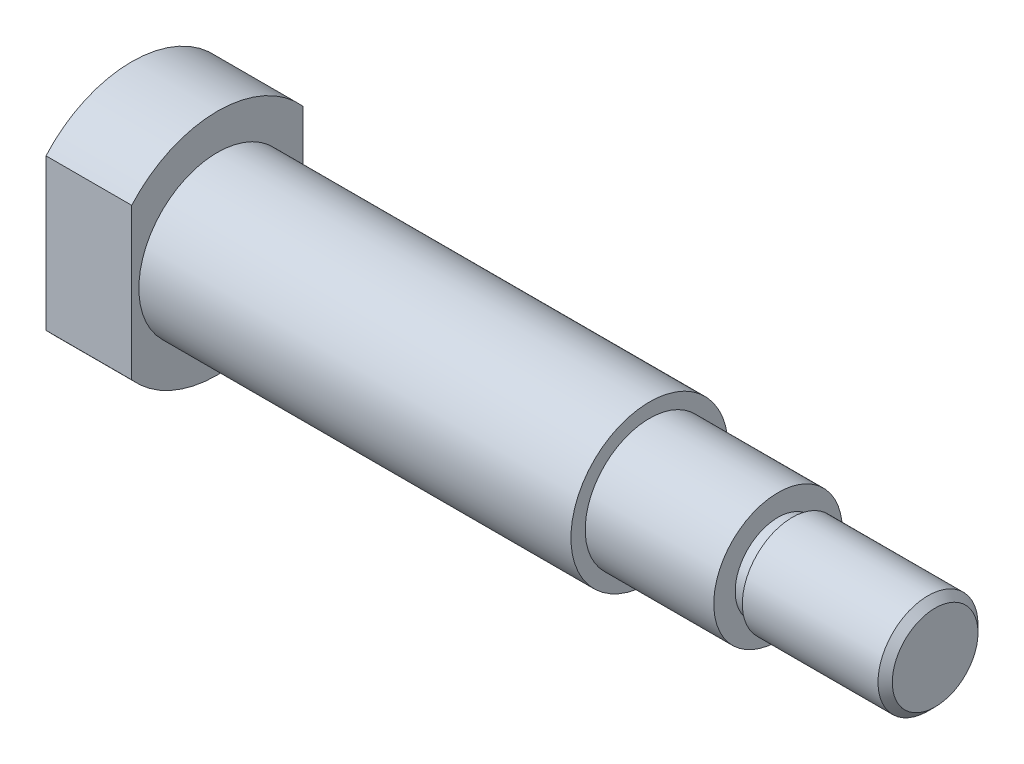
from build123d import *

# Parameters (mm, degrees)
CHAMFER1_SIZE             = 1
CUT_EXTRUDE1_DEPTH        = 12
M5X0_8_TAPPED_HOLE1_D     = 4.2
M5X0_8_TAPPED_HOLE1_DEPTH = 63
M5X0_8_TAPPED_HOLE1_TIP   = 1.2618073


with BuildPart() as part:
    # Sketch1 → Revolve1 (revolve)
    with BuildSketch(Plane.XY, mode=Mode.PRIVATE) as revolve1_sk:
        Polygon((17, 11), (-43.5, 11), (-43.5, 16), (-55.5, 16), (-55.5, 0), (57, 0), (57, 7), (37, 7), (37, 6), (35, 6), (35, 9), (17, 9), align=None)
    revolve(revolve1_sk.sketch.rotate(Axis((57, 0, 0), (-1, 0, 0)), 90), axis=Axis((57, 0, 0), (-1, 0, 0)))

    # Chamfer1
    chamfer1_edges = [part.edges().sort_by_distance(p)[0] for p in [
        (57, 0, 7),
    ]]
    chamfer(chamfer1_edges, length=CHAMFER1_SIZE)

    # Sketch2 → Cut-Extrude1 (cut)
    with BuildSketch(Plane.ZY.offset(55.5)):
        with BuildLine():
            Line((12, 10.583005244), (12, -10.583005244))
            ThreePointArc((12, -10.583005244), (16, 0), (12, 10.583005244))
        make_face()
        with BuildLine():
            Line((-12, 10.583005244), (-12, -10.583005244))
            ThreePointArc((-12, -10.583005244), (-16, 0), (-12, 10.583005244))
        make_face()
    extrude(amount=-CUT_EXTRUDE1_DEPTH, mode=Mode.SUBTRACT)

    # M5x0.8 Tapped Hole1
    with Locations(Plane.ZY.offset(55.5)):
        with Locations((0, 0)):
            Hole(M5X0_8_TAPPED_HOLE1_D / 2, depth=M5X0_8_TAPPED_HOLE1_DEPTH)
            with Locations((0, 0, -(M5X0_8_TAPPED_HOLE1_DEPTH + M5X0_8_TAPPED_HOLE1_TIP / 2))):  # 118° drill point
                Cone(0, M5X0_8_TAPPED_HOLE1_D / 2, M5X0_8_TAPPED_HOLE1_TIP, mode=Mode.SUBTRACT)


solid = part.part
